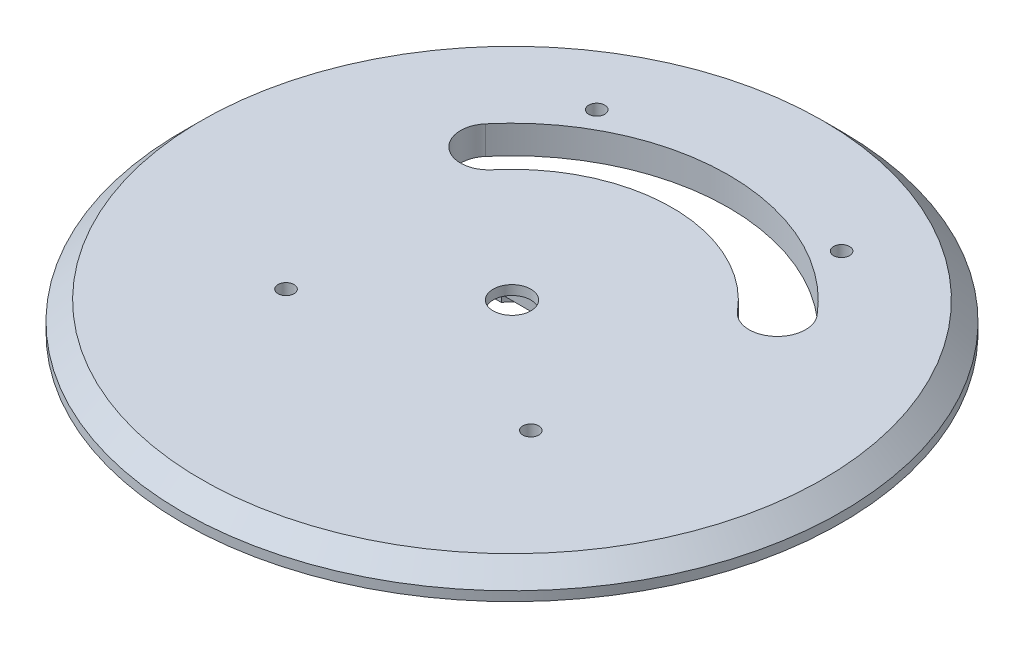
from build123d import *

# Parameters (mm, degrees)
HORN_START                = 52.8
HORN_DOG_POCKET_DEPTH     = 4.2
HUB_START                 = 52.8
SKETCH3_R                 = 8
HUB_RELIEF_DEPTH          = 1.7
CENTRE_START              = 52.8
SKETCH4_R                 = 4
CENTRE_CABLE_KIDNEY_DEPTH = 6.4
TOWER_START               = 52.8
SKETCH5_R                 = 1.7
TOWER_BOLT_HOLES_DEPTH    = 6.4
TOWER_NUT_POCKETS_DEPTH   = 2.9


with BuildPart() as part:
    # Sketch1 → Turntable (revolve)
    with BuildSketch(Plane.XY, mode=Mode.PRIVATE) as turntable_sk:
        Polygon((0, 53), (70, 53), (70, 55), (66, 59), (0, 59), align=None)
    revolve(turntable_sk.sketch.rotate(Axis((0, 40, 0), (0, 1, 0)), 90), axis=Axis((0, 40, 0), (0, 1, 0)))

    # Sketch2 → Horn dog pocket (cut)
    with BuildSketch(Plane(origin=(0, 0, 0), x_dir=(1, 0, 0), z_dir=(0, 1, 0)).offset(HORN_START)):
        with BuildLine():
            Line((-23.1, -4.4), (23.1, -4.4))
            ThreePointArc((23.1, -4.4), (27.5, 0), (23.1, 4.4))
            Line((23.1, 4.4), (-23.1, 4.4))
            ThreePointArc((-23.1, 4.4), (-27.5, 0), (-23.1, -4.4))
        make_face()
    extrude(amount=HORN_DOG_POCKET_DEPTH, mode=Mode.SUBTRACT)

    # Sketch3 → Hub relief (cut)
    with BuildSketch(Plane(origin=(0, 0, 0), x_dir=(1, 0, 0), z_dir=(0, 1, 0)).offset(HUB_START)):
        Circle(SKETCH3_R)
    extrude(amount=HUB_RELIEF_DEPTH, mode=Mode.SUBTRACT)

    # Sketch4 → Centre + cable kidney (cut)
    with BuildSketch(Plane(origin=(0, 0, 0), x_dir=(1, 0, 0), z_dir=(0, 1, 0)).offset(CENTRE_START)):
        with Locations(Location((0, 0, 0), (0, 0, 270))):
            Circle(SKETCH4_R)
        with BuildLine():
            ThreePointArc((-35.238044383, 29.568230046), (0, 46), (35.238044383, 29.568230046))
            ThreePointArc((35.238044383, 29.568230046), (34.498503383, 21.115237729), (26.045511066, 21.854778729))
            ThreePointArc((26.045511066, 21.854778729), (0, 34), (-26.045511066, 21.854778729))
            ThreePointArc((-26.045511066, 21.854778729), (-34.498503383, 21.115237729), (-35.238044383, 29.568230046))
        make_face()
    extrude(amount=CENTRE_CABLE_KIDNEY_DEPTH, mode=Mode.SUBTRACT)

    # Sketch5 → Tower bolt holes (cut)
    with BuildSketch(Plane(origin=(0, 0, 0), x_dir=(1, 0, 0), z_dir=(0, 1, 0)).offset(TOWER_START)):
        with Locations(Location((-26, 44, 0), (0, 0, 90))):
            Circle(SKETCH5_R)
        with Locations(Location((-26, -22, 0), (0, 0, 90))):
            Circle(SKETCH5_R)
        with Locations(Location((26, 44, 0), (0, 0, 90))):
            Circle(SKETCH5_R)
        with Locations(Location((26, -22, 0), (0, 0, 90))):
            Circle(SKETCH5_R)
    extrude(amount=TOWER_BOLT_HOLES_DEPTH, mode=Mode.SUBTRACT)

    # Sketch6 → Tower nut pockets (cut)
    with BuildSketch(Plane(origin=(0, 0, 0), x_dir=(1, 0, 0), z_dir=(0, 1, 0)).offset(TOWER_START)):
        Polygon((-23.05, 42.296816706), (-26, 40.593633412), (-28.95, 42.296816706), (-28.95, 45.703183294), (-26, 47.406366588), (-23.05, 45.703183294), align=None)
        Polygon((-23.05, -23.703183294), (-26, -25.406366588), (-28.95, -23.703183294), (-28.95, -20.296816706), (-26, -18.593633412), (-23.05, -20.296816706), align=None)
        Polygon((28.95, 42.296816706), (26, 40.593633412), (23.05, 42.296816706), (23.05, 45.703183294), (26, 47.406366588), (28.95, 45.703183294), align=None)
        Polygon((28.95, -23.703183294), (26, -25.406366588), (23.05, -23.703183294), (23.05, -20.296816706), (26, -18.593633412), (28.95, -20.296816706), align=None)
    extrude(amount=TOWER_NUT_POCKETS_DEPTH, mode=Mode.SUBTRACT)


solid = part.part
